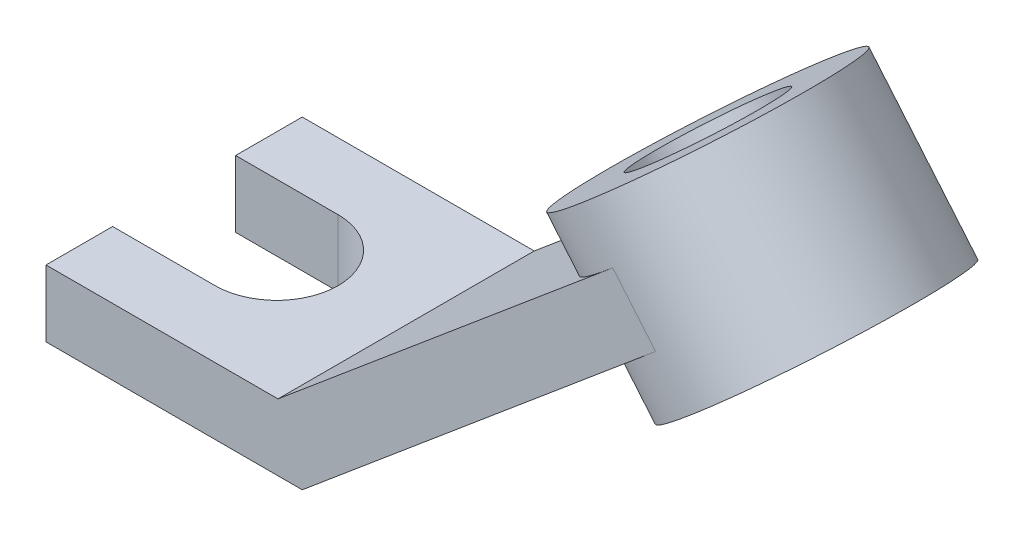
from build123d import *

# Parameters (mm, degrees)
BOSS_EXTRUDE1_DEPTH      = 50
BOSS_EXTRUDE2_DEPTH      = 10
BOSS_EXTRUDE2_DEPTH_BACK = 23
SKETCH3_R                = 25
CUT_EXTRUDE1_REACH       = 173.917
SKETCH6_R                = 13
CUT_EXTRUDE2_DEPTH       = 174.304008792


with BuildPart() as part:
    # Sketch1 → Boss-Extrude1 (new body)
    with BuildSketch(Plane.XY):
        Polygon((0, 6.5), (0, 0), (47.634193477, 0), (114.765880418, 56.330173752), (110.587760955, 61.309462632), (45.268386955, 6.5), align=None)
        Polygon((47.634193477, 0), (0, 0), (0, -6.5), (50, -6.5), (118.943999881, 51.350884872), (114.765880418, 56.330173752), align=None)
    extrude(amount=BOSS_EXTRUDE1_DEPTH)

    # Sketch3 → Boss-Extrude2 (add, two sides: drawn at the far end of the back side and taken through both)
    with BuildSketch(Plane(origin=(15.50318183, -18.475972642, 0), x_dir=(0.7660444431189771, 0.6427876096865404, 0), z_dir=(-0.6427876096865404, 0.7660444431189771, 0)).offset(-BOSS_EXTRUDE2_DEPTH_BACK)):
        with Locations(Location((124.124102693, -25, 0), (0, 0, 180))):
            Circle(SKETCH3_R)
    extrude(amount=BOSS_EXTRUDE2_DEPTH + BOSS_EXTRUDE2_DEPTH_BACK)

    # Sketch5 → Cut-Extrude1 (cut, up to next)
    with BuildSketch(Plane(origin=(0, 6.5, 0), x_dir=(1, 0, 0), z_dir=(0, 1, 0)), mode=Mode.PRIVATE) as cut_extrude1_sk1:
        with BuildLine():
            Line((0, -13), (20, -13))
            ThreePointArc((20, -13), (32, -25), (20, -37))
            Line((20, -37), (0, -37))
            ThreePointArc((0, -37), (-12, -25), (0, -13))
        make_face()
    cut_extrude1_tool1 = extrude(cut_extrude1_sk1.sketch, amount=-CUT_EXTRUDE1_REACH, mode=Mode.PRIVATE) & part.part
    add(cut_extrude1_tool1.solids().sort_by_distance((10, 6.5, 25))[0], mode=Mode.SUBTRACT)

    # Sketch6 → Cut-Extrude2 (cut, through all)
    with BuildSketch(Plane(origin=(9.075305733, -10.815528211, 0), x_dir=(0.7660444431189771, 0.6427876096865404, 0), z_dir=(-0.6427876096865404, 0.7660444431189771, 0))):
        with Locations(Location((124.124102693, -25, 0), (0, 0, 180))):
            Circle(SKETCH6_R)
    extrude(amount=-CUT_EXTRUDE2_DEPTH, mode=Mode.SUBTRACT)


solid = part.part
